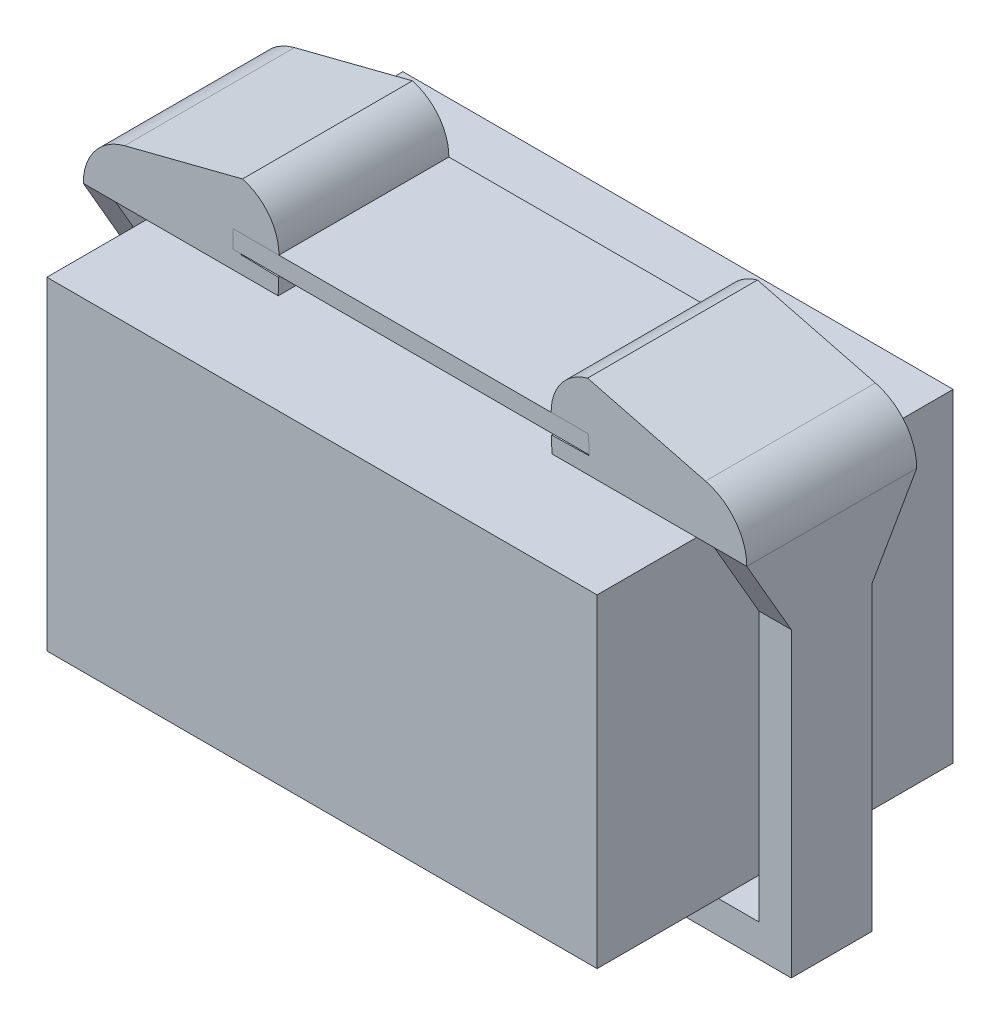
from build123d import *

# Parameters (mm, degrees)
SKETCH1_W                = 45
SKETCH1_H                = 21
BOSS_EXTRUDE1_DEPTH      = 2.2
SKETCH2_W                = 68
SKETCH2_H                = 44
BOSS_EXTRUDE2_DEPTH      = 40
BOSS_EXTRUDE3_DEPTH      = 5
BOSS_EXTRUDE3_DEPTH_BACK = 5
SKETCH4_R                = 2.25
BOSS_EXTRUDE4_DEPTH      = 10.5
BOSS_EXTRUDE4_DEPTH_BACK = 10.5
BOSS_EXTRUDE5_START      = -4
BOSS_EXTRUDE5_DEPTH      = 4


with BuildPart() as part:
    # Sketch1 → Boss-Extrude1 (new body)
    with BuildSketch(Plane(origin=(0, 0, 0), x_dir=(1, 0, 0), z_dir=(0, 1, 0))):
        Rectangle(SKETCH1_W, SKETCH1_H)
    extrude(amount=BOSS_EXTRUDE1_DEPTH)


with BuildPart() as body_2:
    # Sketch2 → Boss-Extrude2 (new body)
    with BuildSketch(Plane(origin=(0, -3, 0), x_dir=(1, 0, 0), z_dir=(0, 1, 0))):
        Rectangle(SKETCH2_W, SKETCH2_H)
    extrude(amount=-BOSS_EXTRUDE2_DEPTH)


with BuildPart() as body_3:
    # Sketch4 → Boss-Extrude3 (new, two sides: drawn at the far end of the back side and taken through both)
    with BuildSketch(Plane.XY.offset(-BOSS_EXTRUDE3_DEPTH_BACK)):
        with BuildLine():
            Line((37, -45), (-37, -45))
            Line((-37, -45), (-37, -2.198533967))
            Line((-37, -2.198533967), (-41, -2.198533967))
            Line((-41, -2.198533967), (-41, -49))
            Line((-41, -49), (-25.5, -49))
            ThreePointArc((-25.5, -49), (0, -54.5), (25.5, -49))
            Line((25.5, -49), (41, -49))
            Line((41, -49), (41, -2.198533967))
            Line((41, -2.198533967), (37, -2.198533967))
            Line((37, -2.198533967), (37, -45))
        make_face()
        with Locations((0, -49.75)):
            Circle(SKETCH4_R, mode=Mode.SUBTRACT)
    extrude(amount=BOSS_EXTRUDE3_DEPTH + BOSS_EXTRUDE3_DEPTH_BACK)

    # Sketch4<4> → Boss-Extrude4 (add, two sides: drawn at the far end of the back side and taken through both)
    with BuildSketch(Plane.XY.offset(-BOSS_EXTRUDE4_DEPTH_BACK)):
        with BuildLine():
            Line((21.318810043, 8.109109109), (35.893105207, 4.379706241))
            ThreePointArc((35.893105207, 4.379706241), (39.5734178, 1.965407035), (41, -2.198533967))
            Line((41, -2.198533967), (37, -2.198533967))
            Line((37, -2.198533967), (16.910081087, -2.198533967))
            Line((16.910081087, -2.198533967), (16.867589097, -0.19898541))
            Line((16.867589097, -0.19898541), (21.5, -0.100543009))
            Line((21.5, -0.100543009), (21.451123178, 2.199456991))
            Line((21.451123178, 2.199456991), (16.818810043, 2.096516699))
            ThreePointArc((16.818810043, 2.096516699), (18.031155865, 5.879423637), (21.318810043, 8.109109109))
        make_face()
        with BuildLine():
            Line((-21.318810043, 8.109109109), (-35.893105207, 4.379706241))
            ThreePointArc((-35.893105207, 4.379706241), (-39.5734178, 1.965407035), (-41, -2.198533967))
            Line((-41, -2.198533967), (-37, -2.198533967))
            Line((-37, -2.198533967), (-16.910081087, -2.198533967))
            Line((-16.910081087, -2.198533967), (-16.867589097, -0.19898541))
            Line((-16.867589097, -0.19898541), (-21.5, -0.100543009))
            Line((-21.5, -0.100543009), (-21.451123178, 2.199456991))
            Line((-21.451123178, 2.199456991), (-16.818810043, 2.096516699))
            ThreePointArc((-16.818810043, 2.096516699), (-18.031155865, 5.879423637), (-21.318810043, 8.109109109))
        make_face()
    extrude(amount=BOSS_EXTRUDE4_DEPTH + BOSS_EXTRUDE4_DEPTH_BACK)

    # Sketch6 → Boss-Extrude5 (add)
    with BuildSketch(Plane(origin=(41, 0, 0), x_dir=(0, 0, -1), z_dir=(1, 0, 0)).offset(BOSS_EXTRUDE5_START)):
        Polygon((10.5, -2.198533967), (5, -11.724813409), (5, -2.198533967), align=None)
        Polygon((-5, -11.724813409), (-5, -2.198533967), (-10.5, -2.198533967), align=None)
    boss_extrude5 = extrude(amount=BOSS_EXTRUDE5_DEPTH)

    # Mirror1: Boss-Extrude5 across plane
    add(boss_extrude5.mirror(Plane(origin=(0, 0, 0), x_dir=(0, 0, 1), z_dir=(1, 0, 0))))


solid = Compound([part.part, body_2.part, body_3.part])
